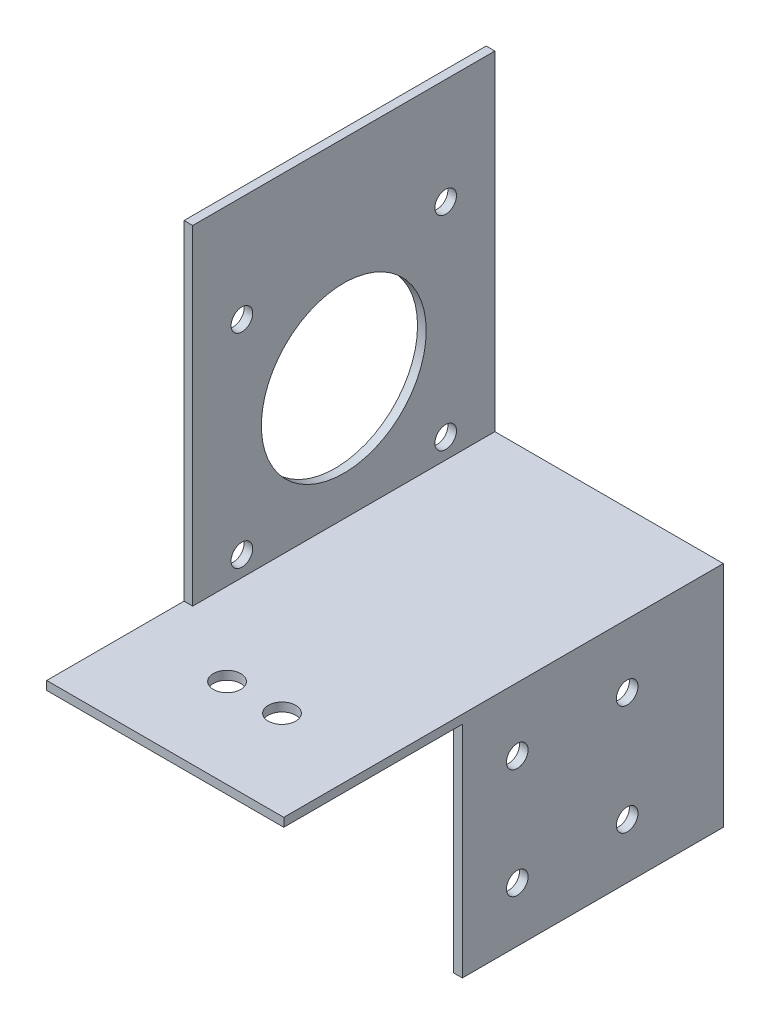
from build123d import *

# Parameters (mm, degrees)
SKETCH1_W           = 69.85
SKETCH1_H           = 50.8
BOSS_EXTRUDE1_DEPTH = 2
SKETCH2_W           = 54.8
SKETCH2_H           = 69.85
BOSS_EXTRUDE2_DEPTH = 2
SKETCH3_W           = 2
SKETCH3_H           = 69.85
BOSS_EXTRUDE3_DEPTH = 76.2
SKETCH4_R           = 19.05
SKETCH4_R_2         = 2.5
CUT_EXTRUDE1_DEPTH  = 122.410689912
SKETCH5_R           = 2.5
SKETCH5_W           = 9.525
SKETCH5_H           = 52.8
CUT_EXTRUDE2_DEPTH  = 123.293726842
SKETCH6_W           = 54.8
SKETCH6_H           = 2
BOSS_EXTRUDE4_DEPTH = 41.275
SKETCH7_R           = 3.175
CUT_EXTRUDE3_DEPTH  = 116.130515612


with BuildPart() as part:
    # Sketch1 → Boss-Extrude1 (new body)
    with BuildSketch(Plane(origin=(0, 0, 0), x_dir=(0, 0, -1), z_dir=(1, 0, 0))):
        Rectangle(SKETCH1_W, SKETCH1_H)
    extrude(amount=-BOSS_EXTRUDE1_DEPTH)

    # Sketch2 → Boss-Extrude2 (add)
    with BuildSketch(Plane(origin=(0, 25.4, 0), x_dir=(1, 0, 0), z_dir=(0, 1, 0))):
        with Locations((-27.4, 0)):
            Rectangle(SKETCH2_W, SKETCH2_H)
    extrude(amount=BOSS_EXTRUDE2_DEPTH)

    # Sketch3 → Boss-Extrude3 (add)
    with BuildSketch(Plane(origin=(0, 27.4, 0), x_dir=(1, 0, 0), z_dir=(0, 1, 0))):
        with Locations((-53.8, 0)):
            Rectangle(SKETCH3_W, SKETCH3_H)
    extrude(amount=BOSS_EXTRUDE3_DEPTH)

    # Sketch4 → Cut-Extrude1 (cut, through all)
    with BuildSketch(Plane(origin=(-52.8, 0, 0), x_dir=(0, 0, -1), z_dir=(1, 0, 0))):
        with Locations((0, 55.567958179)):
            Circle(SKETCH4_R)
        with Locations((23.55, 79.117958179)):
            Circle(SKETCH4_R_2)
        with Locations((-23.55, 79.117958179)):
            Circle(SKETCH4_R_2)
        with Locations((-23.55, 32.017958179)):
            Circle(SKETCH4_R_2)
        with Locations((23.55, 32.017958179)):
            Circle(SKETCH4_R_2)
    extrude(amount=-CUT_EXTRUDE1_DEPTH, mode=Mode.SUBTRACT)

    # Sketch5 → Cut-Extrude2 (cut, through all)
    with BuildSketch(Plane(origin=(0, 0, 0), x_dir=(0, 0, -1), z_dir=(1, 0, 0))):
        with Locations((-12.7, 12.7)):
            Circle(SKETCH5_R)
        with Locations((12.7, 12.7)):
            Circle(SKETCH5_R)
        with Locations((12.7, -12.7)):
            Circle(SKETCH5_R)
        with Locations((-12.7, -12.7)):
            Circle(SKETCH5_R)
        with Locations((-30.1625, 1)):
            Rectangle(SKETCH5_W, SKETCH5_H)
    extrude(amount=-CUT_EXTRUDE2_DEPTH, mode=Mode.SUBTRACT)

    # Sketch6 → Boss-Extrude4 (add)
    with BuildSketch(Plane.XY.offset(25.4)):
        with Locations((-27.4, 26.4)):
            Rectangle(SKETCH6_W, SKETCH6_H)
    extrude(amount=BOSS_EXTRUDE4_DEPTH)

    # Sketch7 → Cut-Extrude3 (cut, through all)
    with BuildSketch(Plane(origin=(0, 27.4, 0), x_dir=(1, 0, 0), z_dir=(0, 1, 0))):
        with Locations(Location((-33.75, -46.0375, 0), (0, 0, 270))):
            Circle(SKETCH7_R)
        with Locations(Location((-21.05, -46.0375, 0), (0, 0, 270))):
            Circle(SKETCH7_R)
    extrude(amount=-CUT_EXTRUDE3_DEPTH, mode=Mode.SUBTRACT)


solid = part.part
